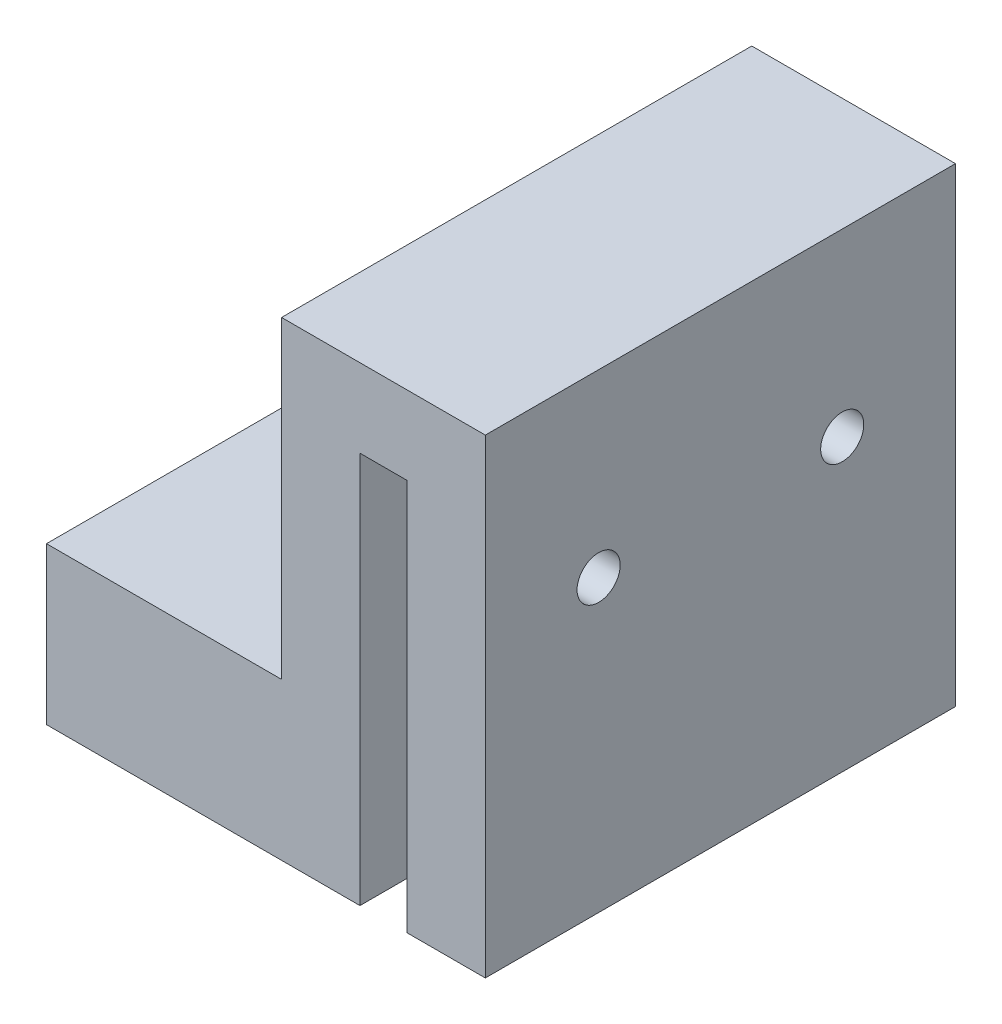
from build123d import *

# Parameters (mm, degrees)
BOSS_EXTRUDE1_DEPTH = 60
SKETCH3_R           = 6
CUT_EXTRUDE1_DEPTH  = 24
CUT_EXTRUDE2_START  = -12
SKETCH3_3_R         = 6
CUT_EXTRUDE2_DEPTH  = 8
SKETCH4_R           = 2.75
CUT_EXTRUDE3_DEPTH  = 30


with BuildPart() as part:
    # Sketch1 → Boss-Extrude1 (new body)
    with BuildSketch(Plane.XY):
        Polygon((0, 0), (0, 60), (-26, 60), (-26, 20), (-56, 20), (-56, 0), (-16, 0), (-16, 50), (-10, 50), (-10, 0), align=None)
    extrude(amount=BOSS_EXTRUDE1_DEPTH)

    # Sketch3 → Cut-Extrude1 (cut)
    with BuildSketch(Plane(origin=(0, 20, 0), x_dir=(1, 0, 0), z_dir=(0, 1, 0))):
        with Locations(Location((-39.443747687, -30, 0), (0, 0, 180))):
            Circle(SKETCH3_R)
    extrude(amount=-CUT_EXTRUDE1_DEPTH, mode=Mode.SUBTRACT)

    # Sketch3<3> → Cut-Extrude2 (cut)
    with BuildSketch(Plane(origin=(0, 20, 0), x_dir=(1, 0, 0), z_dir=(0, 1, 0)).offset(CUT_EXTRUDE2_START)):
        Polygon((-31, -25.125), (-39.443747687, -20.25), (-47.887495374, -25.125), (-47.887495374, -34.875), (-39.443747687, -39.75), (-31, -34.875), align=None)
        with Locations(Location((-39.443747687, -30, 0), (0, 0, 180))):
            Circle(SKETCH3_3_R, mode=Mode.SUBTRACT)
    extrude(amount=-CUT_EXTRUDE2_DEPTH, mode=Mode.SUBTRACT)

    # Sketch4 → Cut-Extrude3 (cut)
    with BuildSketch(Plane.ZY.offset(26)):
        with Locations((14.458646622, 37.03116756)):
            Circle(SKETCH4_R)
        with Locations((45.541353378, 37.03116756)):
            Circle(SKETCH4_R)
    extrude(amount=-CUT_EXTRUDE3_DEPTH, mode=Mode.SUBTRACT)


solid = part.part
